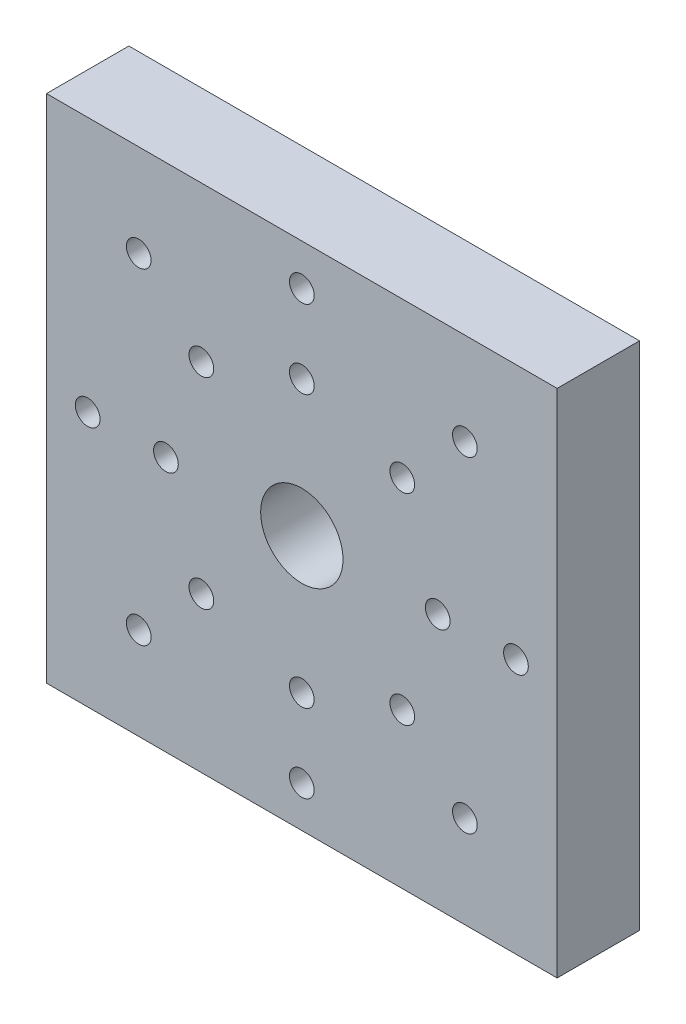
from build123d import *

# Parameters (mm, degrees)
SKETCH1_W           = 62
SKETCH1_H           = 62
SKETCH1_R           = 1.5
BOSS_EXTRUDE1_DEPTH = 10
SKETCH2_R           = 1.5
CUT_EXTRUDE1_DEPTH  = 10
SKETCH3_R           = 1.5
CUT_EXTRUDE2_DEPTH  = 10
SKETCH4_R           = 5
SKETCH4_R_2         = 1.5
CUT_EXTRUDE3_DEPTH  = 10


with BuildPart() as part:
    # Sketch1 → Boss-Extrude1 (new body)
    with BuildSketch(Plane.XY):
        Rectangle(SKETCH1_W, SKETCH1_H)
        with Locations((0, 16.5)):
            Circle(SKETCH1_R, mode=Mode.SUBTRACT)
        with Locations((16.5, 0)):
            Circle(SKETCH1_R, mode=Mode.SUBTRACT)
        with Locations((0, -16.5)):
            Circle(SKETCH1_R, mode=Mode.SUBTRACT)
        with Locations((-16.5, 0)):
            Circle(SKETCH1_R, mode=Mode.SUBTRACT)
    extrude(amount=BOSS_EXTRUDE1_DEPTH)

    # Sketch2 → Cut-Extrude1 (cut)
    with BuildSketch(Plane(origin=(0, 0, 0), x_dir=(-1, 0, 0), z_dir=(0, 0, -1))):
        with Locations((-12.197591975, 12.197591975)):
            Circle(SKETCH2_R)
        with Locations((-12.197591975, -12.197591975)):
            Circle(SKETCH2_R)
        with Locations((12.197591975, -12.197591975)):
            Circle(SKETCH2_R)
        with Locations((12.197591975, 12.197591975)):
            Circle(SKETCH2_R)
    extrude(amount=-CUT_EXTRUDE1_DEPTH, mode=Mode.SUBTRACT)

    # Sketch3 → Cut-Extrude2 (cut)
    with BuildSketch(Plane(origin=(0, 0, 0), x_dir=(-1, 0, 0), z_dir=(0, 0, -1))):
        with Locations((-26, 0)):
            Circle(SKETCH3_R)
        with Locations((0, 26)):
            Circle(SKETCH3_R)
        with Locations((26, 0)):
            Circle(SKETCH3_R)
        with Locations((0, -26)):
            Circle(SKETCH3_R)
    extrude(amount=-CUT_EXTRUDE2_DEPTH, mode=Mode.SUBTRACT)

    # Sketch4 → Cut-Extrude3 (cut)
    with BuildSketch(Plane(origin=(0, 0, 0), x_dir=(-1, 0, 0), z_dir=(0, 0, -1))):
        Circle(SKETCH4_R)
        with Locations((-19.798989873, 19.798989873)):
            Circle(SKETCH4_R_2)
        with Locations((19.798989873, 19.798989873)):
            Circle(SKETCH4_R_2)
        with Locations((19.798989873, -19.798989873)):
            Circle(SKETCH4_R_2)
        with Locations((-19.798989873, -19.798989873)):
            Circle(SKETCH4_R_2)
    extrude(amount=-CUT_EXTRUDE3_DEPTH, mode=Mode.SUBTRACT)


solid = part.part
